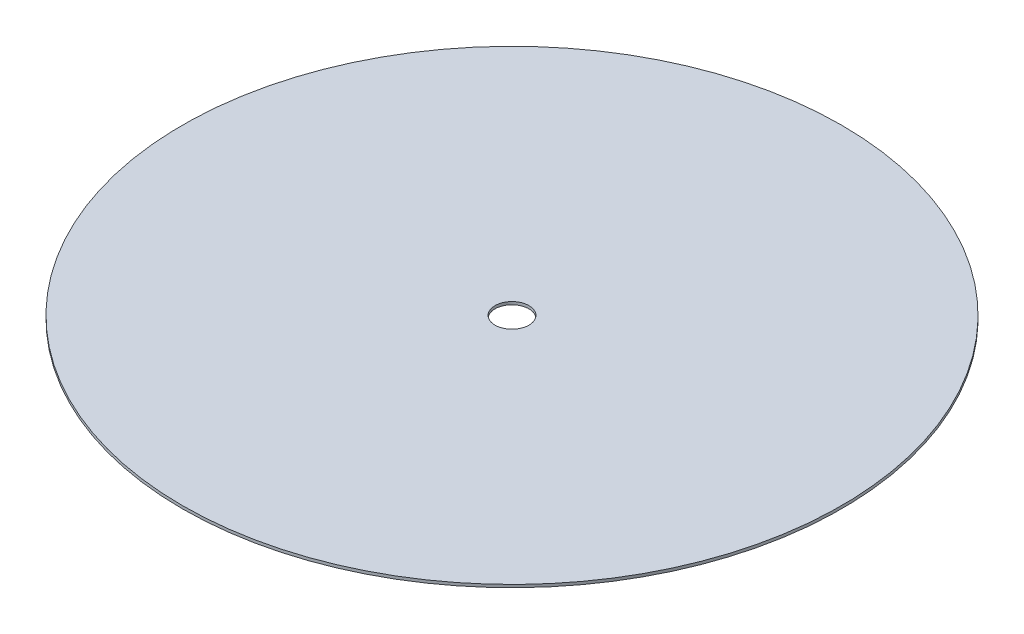
from build123d import *

# Parameters (mm, degrees)
SKETCH1_R           = 1750
BOSS_EXTRUDE1_DEPTH = 15
SKETCH2_R           = 90
CUT_EXTRUDE1_DEPTH  = 50


with BuildPart() as part:
    # Sketch1 → Boss-Extrude1 (new body)
    with BuildSketch(Plane(origin=(0, 0, 0), x_dir=(1, 0, 0), z_dir=(0, 1, 0))):
        with Locations(Location((0, 0, 0), (0, 0, 270))):
            Circle(SKETCH1_R)
    extrude(amount=BOSS_EXTRUDE1_DEPTH)

    # Sketch2 → Cut-Extrude1 (cut)
    with BuildSketch(Plane(origin=(0, 15, 0), x_dir=(1, 0, 0), z_dir=(0, 1, 0))):
        with Locations(Location((0, 0, 0), (0, 0, 270))):
            Circle(SKETCH2_R)
    extrude(amount=-CUT_EXTRUDE1_DEPTH, mode=Mode.SUBTRACT)


solid = part.part
